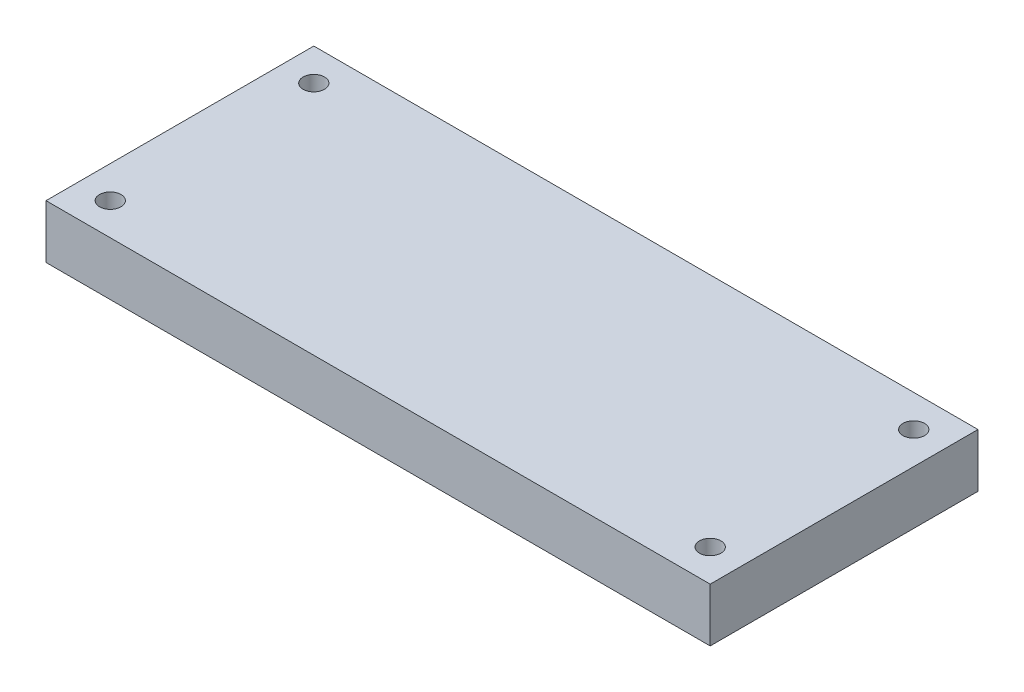
from build123d import *

# Parameters (mm, degrees)
SCHIZZO1_W                   = 62
SCHIZZO1_H                   = 25
ESTRUSIONE_ESTRUSIONE1_DEPTH = 5
SCHIZZO2_R                   = 1
TAGLIO_ESTRUSIONE1_DEPTH     = 5


with BuildPart() as part:
    # Schizzo1 → Estrusione-Estrusione1 (new body)
    with BuildSketch(Plane(origin=(0, 0, 0), x_dir=(1, 0, 0), z_dir=(0, 1, 0))):
        Rectangle(SCHIZZO1_W, SCHIZZO1_H)
    extrude(amount=ESTRUSIONE_ESTRUSIONE1_DEPTH)

    # Schizzo2 → Taglio-Estrusione1 (cut)
    with BuildSketch(Plane(origin=(0, 5, 0), x_dir=(1, 0, 0), z_dir=(0, 1, 0))):
        with Locations(Location((-28, 9.5, 0), (0, 0, 270))):
            Circle(SCHIZZO2_R)
        with Locations(Location((-28, -9.5, 0), (0, 0, 270))):
            Circle(SCHIZZO2_R)
        with Locations(Location((28, 9.5, 0), (0, 0, 270))):
            Circle(SCHIZZO2_R)
        with Locations(Location((28, -9.5, 0), (0, 0, 270))):
            Circle(SCHIZZO2_R)
    extrude(amount=-TAGLIO_ESTRUSIONE1_DEPTH, mode=Mode.SUBTRACT)


solid = part.part
